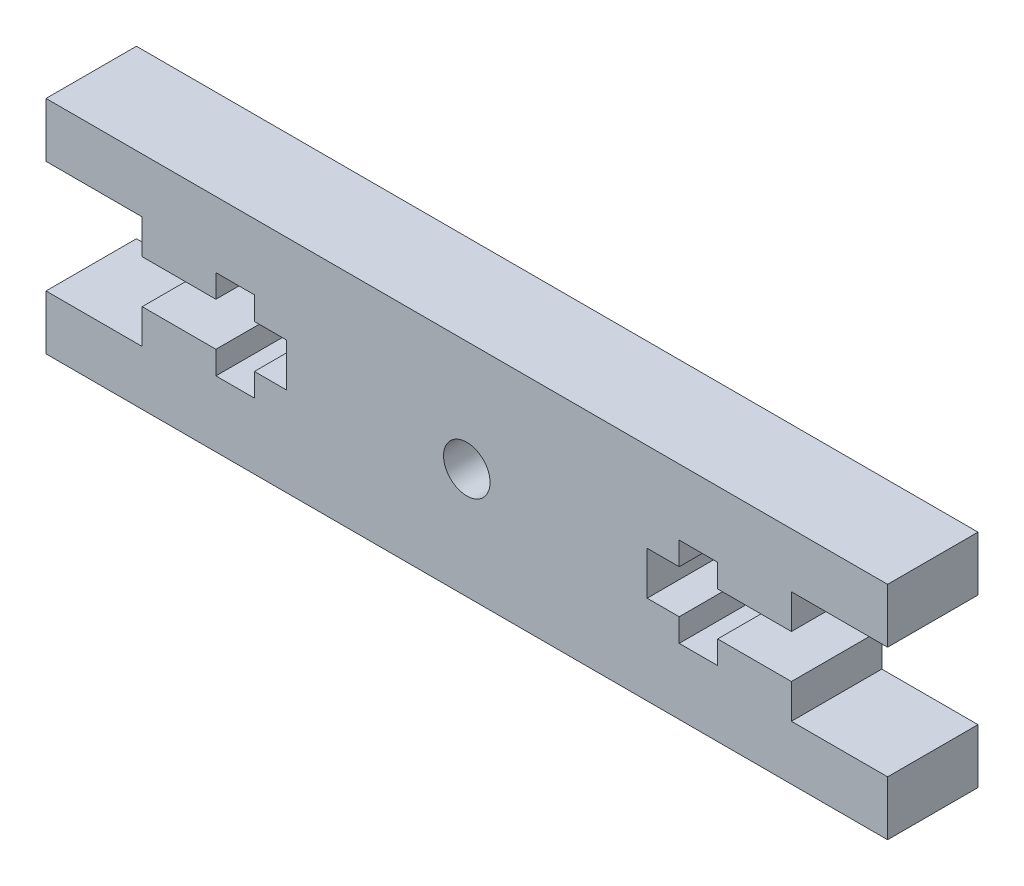
from build123d import *

# Parameters (mm, degrees)
SKETCH1_R           = 1.45
BOSS_EXTRUDE2_DEPTH = 5.64


with BuildPart() as part:
    # Sketch1 → Boss-Extrude2 (new body)
    with BuildSketch(Plane.XY):
        Polygon((727.33944815, 349.198465228), (779.83944815, 349.198465228), (779.83944815, 345.798465228), (773.83944815, 345.798465228), (773.83944815, 343.648465228), (769.23944815, 343.648465228), (769.23944815, 345.088465228), (766.83944815, 345.088465228), (766.83944815, 343.648465228), (764.83944815, 343.648465228), (764.83944815, 340.948465228), (766.83944815, 340.948465228), (766.83944815, 339.508465228), (769.23944815, 339.508465228), (769.23944815, 340.948465228), (773.83944815, 340.948465228), (773.83944815, 338.798465228), (779.83944815, 338.798465228), (779.83944815, 335.398465228), (727.33944815, 335.398465228), (727.33944815, 338.798465228), (733.33944815, 338.798465228), (733.33944815, 340.948465228), (737.93944815, 340.948465228), (737.93944815, 339.508465228), (740.33944815, 339.508465228), (740.33944815, 340.948465228), (742.33944815, 340.948465228), (742.33944815, 343.648465228), (740.33944815, 343.648465228), (740.33944815, 345.088465228), (737.93944815, 345.088465228), (737.93944815, 343.648465228), (733.33944815, 343.648465228), (733.33944815, 345.798465228), (727.33944815, 345.798465228), align=None)
        with Locations((753.58944815, 342.298465228)):
            Circle(SKETCH1_R, mode=Mode.SUBTRACT)
    extrude(amount=BOSS_EXTRUDE2_DEPTH)


solid = part.part
